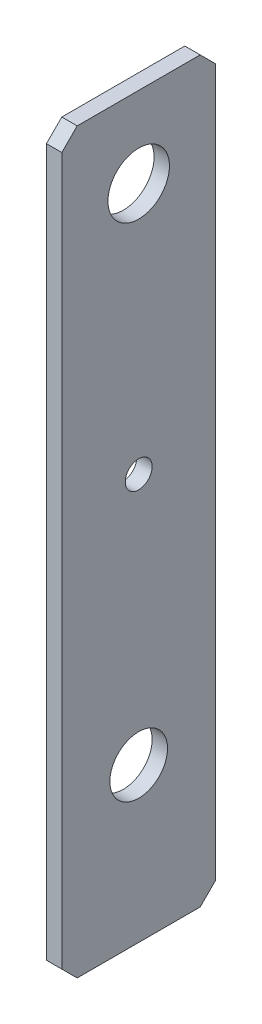
from build123d import *

# Parameters (mm, degrees)
SKETCH1_W           = 20
SKETCH1_H           = 96
BOSS_EXTRUDE2_DEPTH = 2
SKETCH3_R           = 1.75
SKETCH3_R_2         = 4
SKETCH3_R_3         = 3.75
CUT_EXTRUDE1_DEPTH  = 50.071376586
CHAMFER1_SIZE       = 2


with BuildPart() as part:
    # Sketch1 → Boss-Extrude2 (new body)
    with BuildSketch(Plane(origin=(0, 0, 0), x_dir=(0, 0, -1), z_dir=(1, 0, 0))):
        Rectangle(SKETCH1_W, SKETCH1_H)
    extrude(amount=BOSS_EXTRUDE2_DEPTH)

    # Sketch3 → Cut-Extrude1 (cut, through all)
    with BuildSketch(Plane(origin=(2, 0, 0), x_dir=(0, 0, -1), z_dir=(1, 0, 0))):
        with Locations((0, 4.75)):
            Circle(SKETCH3_R)
        with Locations((0, 37.5)):
            Circle(SKETCH3_R_2)
        with Locations((0, -28)):
            Circle(SKETCH3_R_3)
    extrude(amount=-CUT_EXTRUDE1_DEPTH, mode=Mode.SUBTRACT)

    # Chamfer1
    chamfer1_edges = [part.edges().sort_by_distance(p)[0] for p in [
        (1, -48, -10),
        (1, -48, 10),
        (1, 48, 10),
        (1, 48, -10),
    ]]
    chamfer(chamfer1_edges, length=CHAMFER1_SIZE)


solid = part.part
